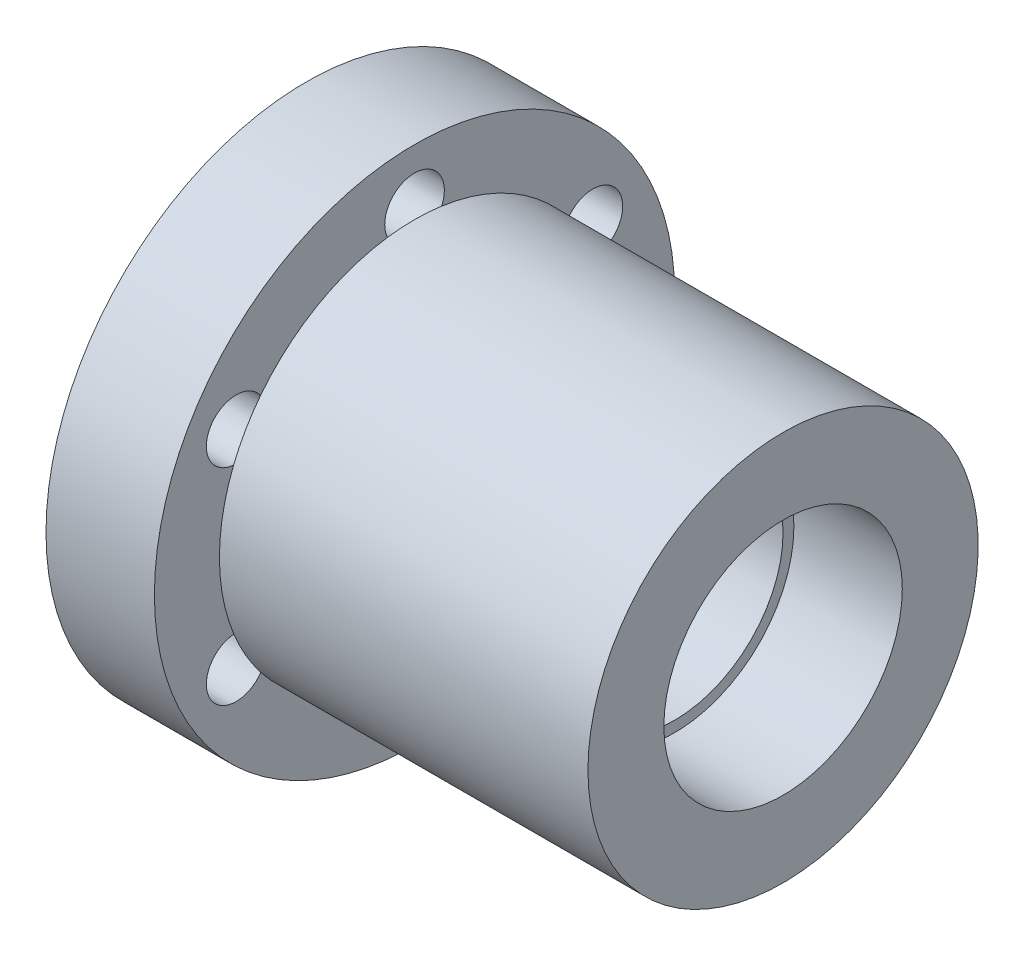
from build123d import *

# Parameters (mm, degrees)
SKETCH2_R          = 2.75
CUT_EXTRUDE1_DEPTH = 10


with BuildPart() as part:
    # Sketch1 → Revolve1 (revolve)
    with BuildSketch(Plane.XY, mode=Mode.PRIVATE) as revolve1_sk:
        Polygon((10, 0), (10, 6), (44, 6), (44, 13), (34, 13), (34, 14), (10, 14), (10, 13), (0, 13), (0, 0), align=None)
    revolve(revolve1_sk.sketch.rotate(Axis((0, 24, 0), (1, 0, 0)), 270), axis=Axis((0, 24, 0), (1, 0, 0)))

    # Sketch2 → Cut-Extrude1 (cut)
    with BuildSketch(Plane.ZY):
        with Locations((0, 42.971966769)):
            Circle(SKETCH2_R)
        with Locations((16.454482672, 33.471966769)):
            Circle(SKETCH2_R)
        with Locations((16.454482672, 14.471966769)):
            Circle(SKETCH2_R)
        with Locations((0, 4.971966769)):
            Circle(SKETCH2_R)
        with Locations((-16.454482672, 14.471966769)):
            Circle(SKETCH2_R)
        with Locations((-16.454482672, 33.471966769)):
            Circle(SKETCH2_R)
    extrude(amount=-CUT_EXTRUDE1_DEPTH, mode=Mode.SUBTRACT)


solid = part.part
